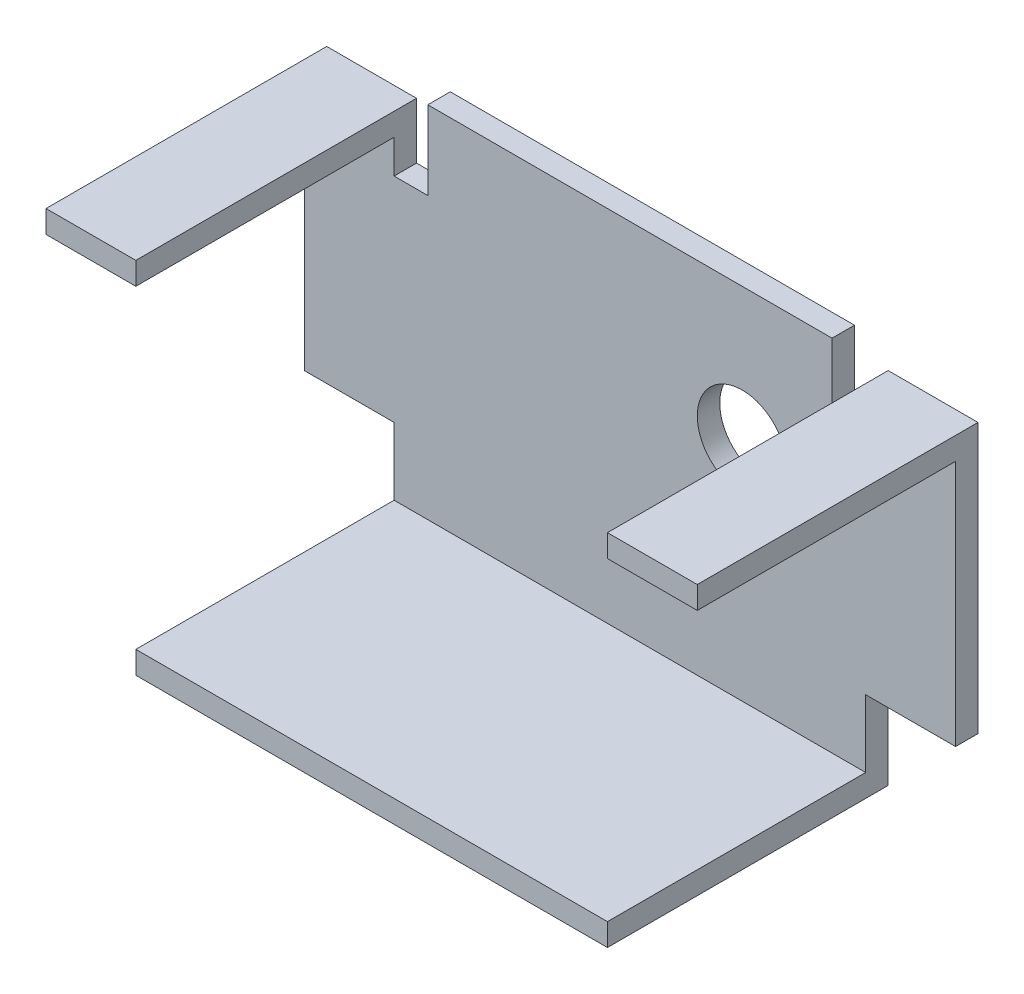
from build123d import *

# Parameters (mm, degrees)
SKETCH1_W           = 42
SKETCH1_H           = 25
BOSS_EXTRUDE1_DEPTH = 2
BOSS_EXTRUDE2_DEPTH = 2
SKETCH2_R           = 4
CUT_EXTRUDE1_DEPTH  = 2
SKETCH3_W           = 8
SKETCH3_H           = 2
BOSS_EXTRUDE3_DEPTH = 23


with BuildPart() as part:
    # Sketch1 → Boss-Extrude1 (new body)
    with BuildSketch(Plane(origin=(0, 0, 0), x_dir=(1, 0, 0), z_dir=(0, 1, 0))):
        with Locations((-21, 12.5)):
            Rectangle(SKETCH1_W, SKETCH1_H)
    extrude(amount=BOSS_EXTRUDE1_DEPTH)

    # 3DSketch1 → Boss-Extrude2 (add)
    with BuildSketch(Plane(origin=(0, 2, -25), x_dir=(-0.8575119035010357, 0.5144641244577025, 0), z_dir=(0, 0, -1))):
        Polygon((0, 0), (3.086784747, 5.145071421), (-3.773310481, 9.260784417), (8.573828506, 29.841070101), (15.433923734, 25.725357105), (12.861603111, 21.437797588), (15.434138822, 19.894405214), (19.035387693, 25.896988539), (49.905816556, 7.376279856), (46.304567685, 1.373696531), (48.877103396, -0.169695842), (51.449424018, 4.117863675), (58.308228487, 0), (45.962379922, -20.578134802), (39.102284694, -16.462421806), (36.015499947, -21.607493227), align=None)
    extrude(amount=-BOSS_EXTRUDE2_DEPTH)

    # Sketch2 → Cut-Extrude1 (cut)
    with BuildSketch(Plane.XY.offset(-23)):
        with Locations((-11, 22)):
            Circle(SKETCH2_R)
    extrude(amount=-CUT_EXTRUDE1_DEPTH, mode=Mode.SUBTRACT)

    # Sketch3 → Boss-Extrude3 (add)
    with BuildSketch(Plane.XY.offset(-23)):
        Polygon((-50, 31.997491717), (-50, 29.997491717), (-42.000000393, 29.997491717), (-42.000000393, 32), align=None)
        with Locations((4, 31)):
            Rectangle(SKETCH3_W, SKETCH3_H)
    extrude(amount=BOSS_EXTRUDE3_DEPTH)


solid = part.part
